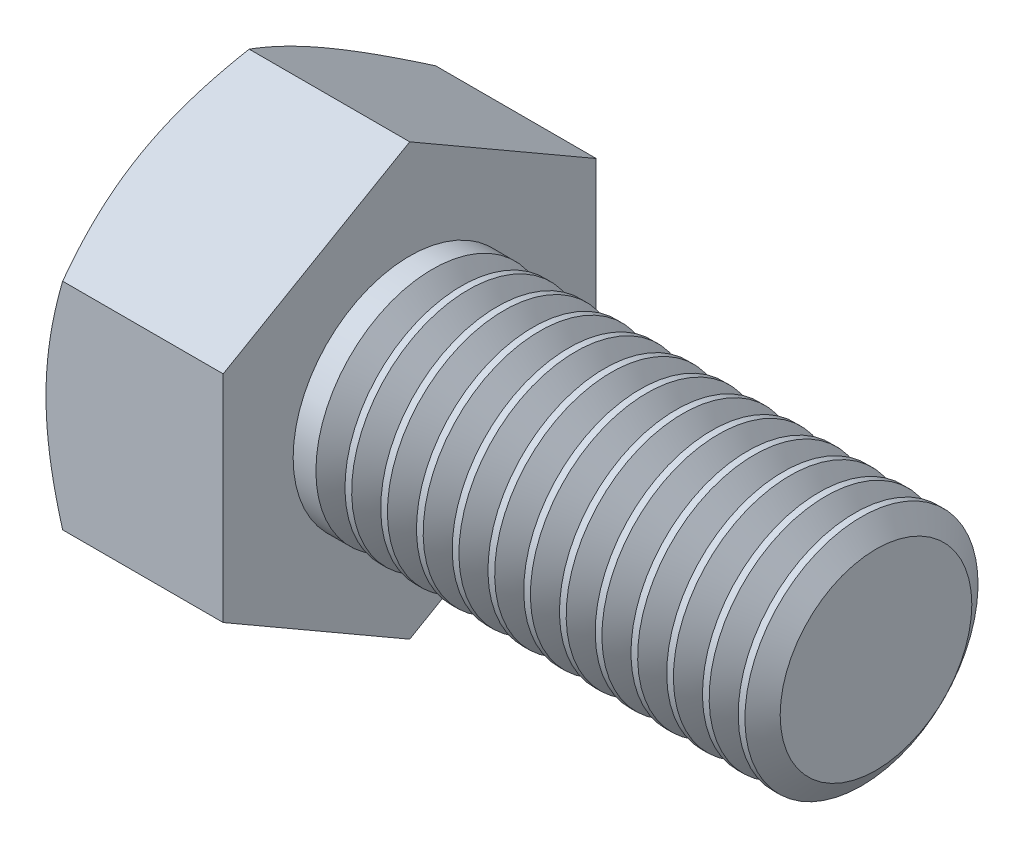
from build123d import *

# Parameters (mm, degrees)
SKETCH2_R       = 4.665127021
HEX_DIE_DEPTH   = 3.8
SKETCH4_R       = 3.5
INDENT_DEPTH    = 0.475
THDSCHPAT_COUNT = 13
THDSCHPAT_PITCH = 0.766666667


with BuildPart() as part:
    # BodySke → Base-Revolve (revolve)
    with BuildSketch(Plane.XY, mode=Mode.PRIVATE) as base_revolve_sk:
        Polygon((3.8, 2.5), (3.8, 4.618937644), (0.357343816, 4.618937644), (0, 4), (0, 0), (13.8, 0), (13.8, 2.5), align=None)
    revolve(base_revolve_sk.sketch.rotate(Axis((-25.4, 0, 0), (1, 0, 0)), 90), axis=Axis((-25.4, 0, 0), (1, 0, 0)))

    # Sketch2 → Hex-Die (cut)
    with BuildSketch(Plane(origin=(0, 0, 0), x_dir=(0, 0, -1), z_dir=(1, 0, 0))):
        Circle(SKETCH2_R)
        Polygon((-4, 2.309401087), (0, 4.618802174), (4, 2.309401087), (4, -2.309401087), (0, -4.618802174), (-4, -2.309401087), align=None, mode=Mode.SUBTRACT)
    extrude(amount=HEX_DIE_DEPTH, mode=Mode.SUBTRACT)

    # Sketch4 → Indent (cut)
    with BuildSketch(Plane(origin=(0, 0, 0), x_dir=(0, 0, -1), z_dir=(1, 0, 0))):
        with Locations(Location((0, 0, 0), (0, 0, 180))):
            Circle(SKETCH4_R)
    extrude(amount=INDENT_DEPTH, mode=Mode.SUBTRACT)

    # ThdSchSke → ThreadSchematic (revolve, cut)
    with BuildSketch(Plane.XY):
        Polygon((4.6, -2.055), (4.288407645, -2.5), (4.288407645, -3.125), (4.911592355, -3.125), (4.911592355, -2.5), align=None)
    threadschematic = revolve(axis=Axis((-3.175, 0, 0), (1, 0, 0)), mode=Mode.SUBTRACT)

    # ThdSchPat: ThreadSchematic ×13
    with Locations(*[(i * THDSCHPAT_PITCH, 0, 0) for i in range(1, THDSCHPAT_COUNT)]):
        add(threadschematic, mode=Mode.SUBTRACT)


solid = part.part
